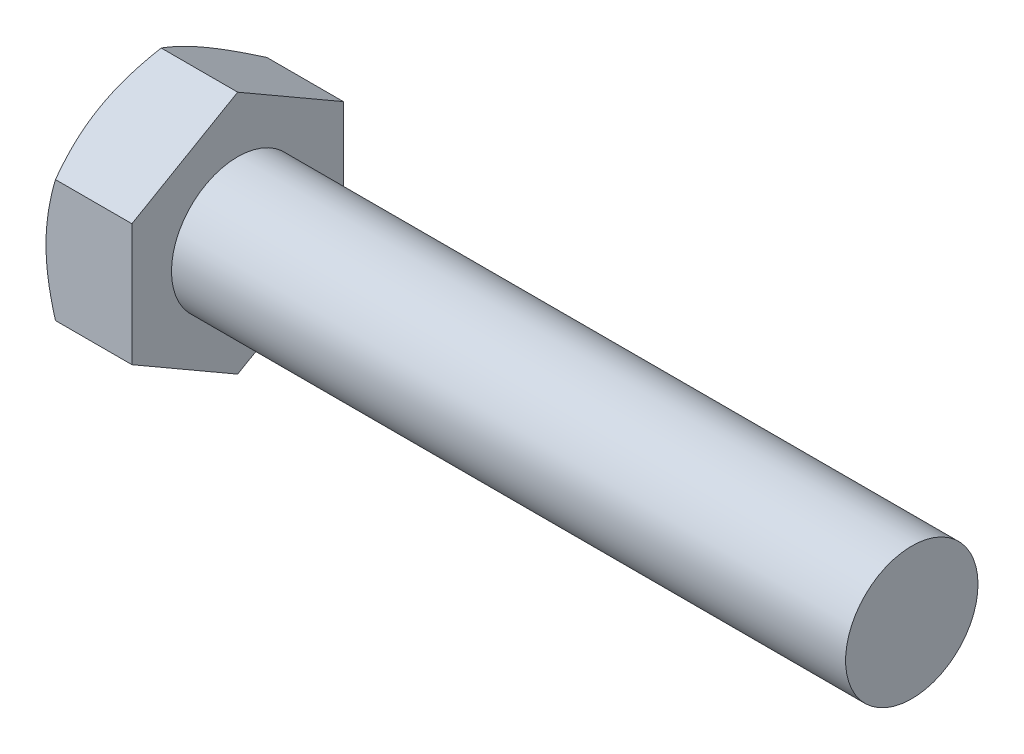
from build123d import *

# Parameters (mm, degrees)
SKETCH5_R           = 3.9751
BOSS_EXTRUDE3_DEPTH = 40.48125
BOSS_EXTRUDE4_DEPTH = 5.159375
SKETCH8_OUTSIDE_W   = 189.718
SKETCH8_OUTSIDE_H   = 191.682
SKETCH8_OUTSIDE_R   = 6.35
CUT_EXTRUDE3_DEPTH  = 47.659966607
CUT_EXTRUDE3_DRAFT  = -60


with BuildPart() as part:
    # Sketch5 → Boss-Extrude3 (new body)
    with BuildSketch(Plane(origin=(22.8203125, 0, 0), x_dir=(0, 0, -1), z_dir=(1, 0, 0))):
        Circle(SKETCH5_R)
    extrude(amount=-BOSS_EXTRUDE3_DEPTH)

    # Sketch6 → Boss-Extrude4 (add)
    with BuildSketch(Plane.ZY.offset(17.6609375)):
        Polygon((6.35, 3.666174209), (0, 7.332348419), (-6.35, 3.666174209), (-6.35, -3.666174209), (0, -7.332348419), (6.35, -3.666174209), align=None)
    extrude(amount=BOSS_EXTRUDE4_DEPTH)


with BuildPart() as cut_extrude3_tool:
    # Sketch8 outside → Cut-Extrude3 (with draft: the straight prism first)
    with BuildSketch(Plane.ZY.offset(22.8203125)):
        Rectangle(SKETCH8_OUTSIDE_W, SKETCH8_OUTSIDE_H)
        Circle(SKETCH8_OUTSIDE_R, mode=Mode.SUBTRACT)
    extrude(amount=-CUT_EXTRUDE3_DEPTH)
    # Cut-Extrude3: the draft: its side faces are tilted about the plane it starts from
    cut_extrude3_sides = [cut_extrude3_tool.faces().sort_by_distance(p)[0] for p in [
        (1.009670803, -95.841, 0),
        (1.009670803, 0, 94.859),
        (1.009670803, 95.841, 0),
        (1.009670803, 0, -94.859),
        (1.009670803, 0, -6.35),
    ]]
    draft(cut_extrude3_sides, Plane.ZY.offset(22.8203125), CUT_EXTRUDE3_DRAFT)


with BuildPart() as part_1:
    add(part.part)

    # Cut-Extrude3: cut by cut_extrude3_tool
    add(cut_extrude3_tool.part, mode=Mode.SUBTRACT)


solid = part_1.part
